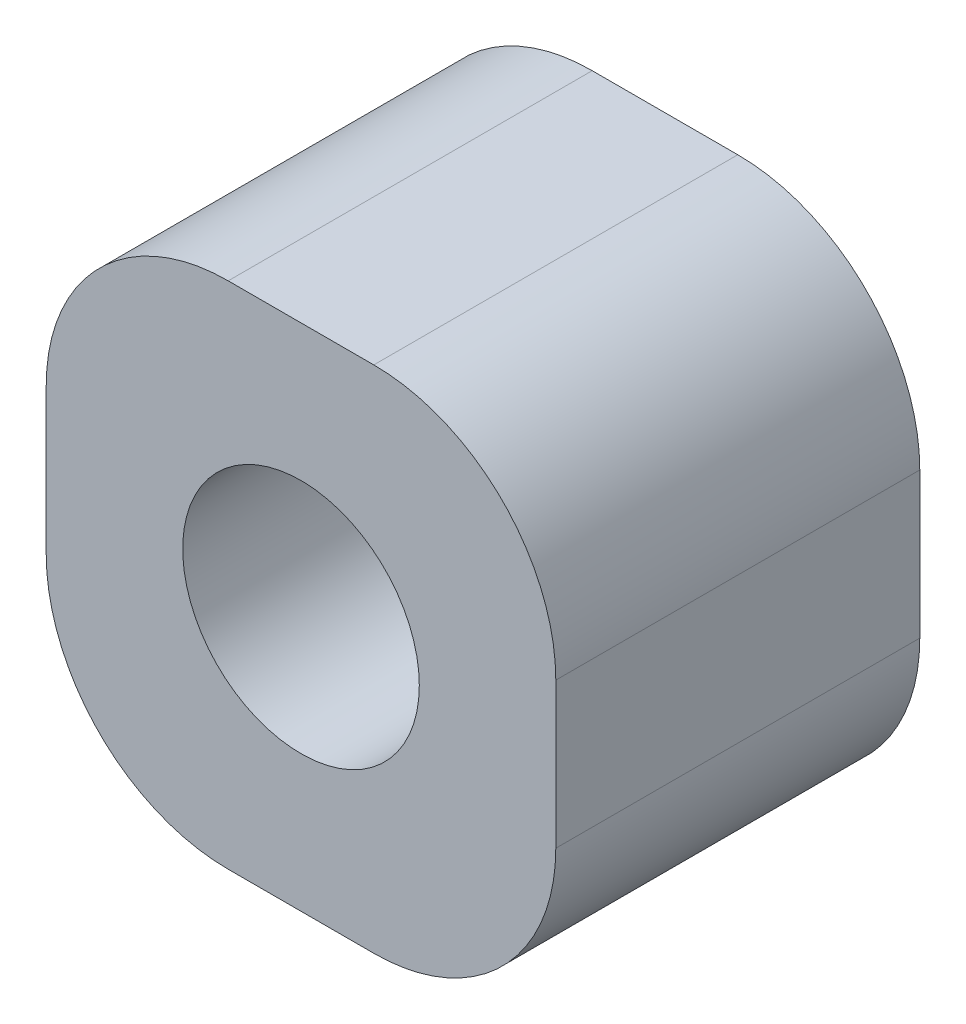
from build123d import *

# Parameters (mm, degrees)
SKETCH1_W           = 14
SKETCH1_H           = 14
SKETCH1_R           = 3.25
BOSS_EXTRUDE1_DEPTH = 10
FILLET1_R           = 5


with BuildPart() as part:
    # Sketch1 → Boss-Extrude1 (new body)
    with BuildSketch(Plane.XY):
        with Locations((7, 7)):
            Rectangle(SKETCH1_W, SKETCH1_H)
        with Locations((7, 7)):
            Circle(SKETCH1_R, mode=Mode.SUBTRACT)
    extrude(amount=BOSS_EXTRUDE1_DEPTH)

    # Fillet1
    fillet1_edges = [part.edges().sort_by_distance(p)[0] for p in [
        (0, 14, 5),
        (14, 14, 5),
        (14, 0, 5),
        (0, 0, 5),
    ]]
    fillet(fillet1_edges, radius=FILLET1_R)


solid = part.part
